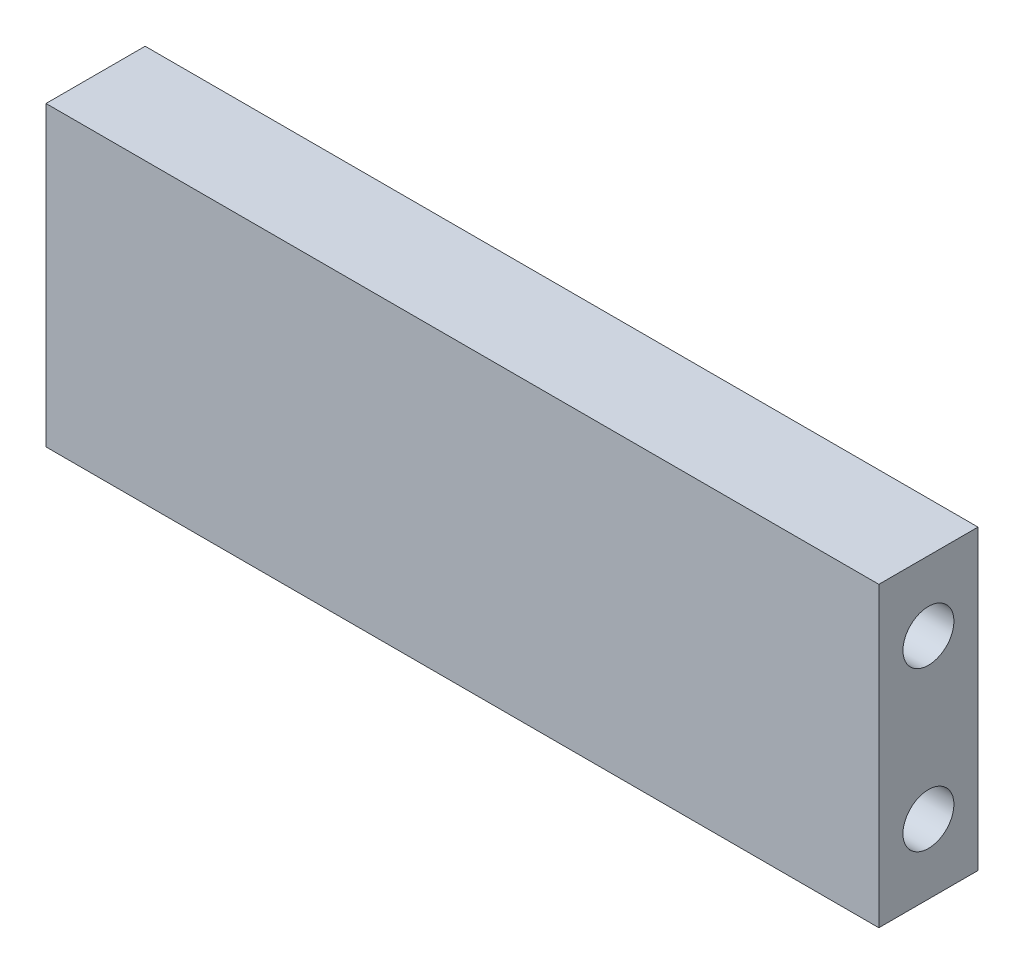
from build123d import *

# Parameters (mm, degrees)
SKETCH1_W           = 106.68
SKETCH1_H           = 38.1
BOSS_EXTRUDE1_DEPTH = 12.7
SKETCH2_R           = 3.2639
CUT_EXTRUDE1_DEPTH  = 22.225
CUT_EXTRUDE2_START  = -22.225
SKETCH3_R           = 3.2639
CUT_EXTRUDE2_DEPTH  = 22.225


with BuildPart() as part:
    # Sketch1 → Boss-Extrude1 (new body)
    with BuildSketch(Plane.XY):
        Rectangle(SKETCH1_W, SKETCH1_H)
    extrude(amount=BOSS_EXTRUDE1_DEPTH)

    # Sketch2 → Cut-Extrude1 (cut)
    with BuildSketch(Plane(origin=(53.34, 0, 0), x_dir=(0, 0, -1), z_dir=(1, 0, 0))):
        with Locations((-6.35, 10.16)):
            Circle(SKETCH2_R)
        with Locations(Location((-6.35, -10.16, 0), (0, 0, 180))):
            Circle(SKETCH2_R)
    extrude(amount=-CUT_EXTRUDE1_DEPTH, mode=Mode.SUBTRACT)

    # Sketch3 → Cut-Extrude2 (cut)
    with BuildSketch(Plane.ZY.offset(53.34).offset(CUT_EXTRUDE2_START)):
        with Locations(Location((6.35, 10.16, 0), (0, 0, 180))):
            Circle(SKETCH3_R)
        with Locations((6.35, -10.16)):
            Circle(SKETCH3_R)
    extrude(amount=CUT_EXTRUDE2_DEPTH, mode=Mode.SUBTRACT)


solid = part.part
